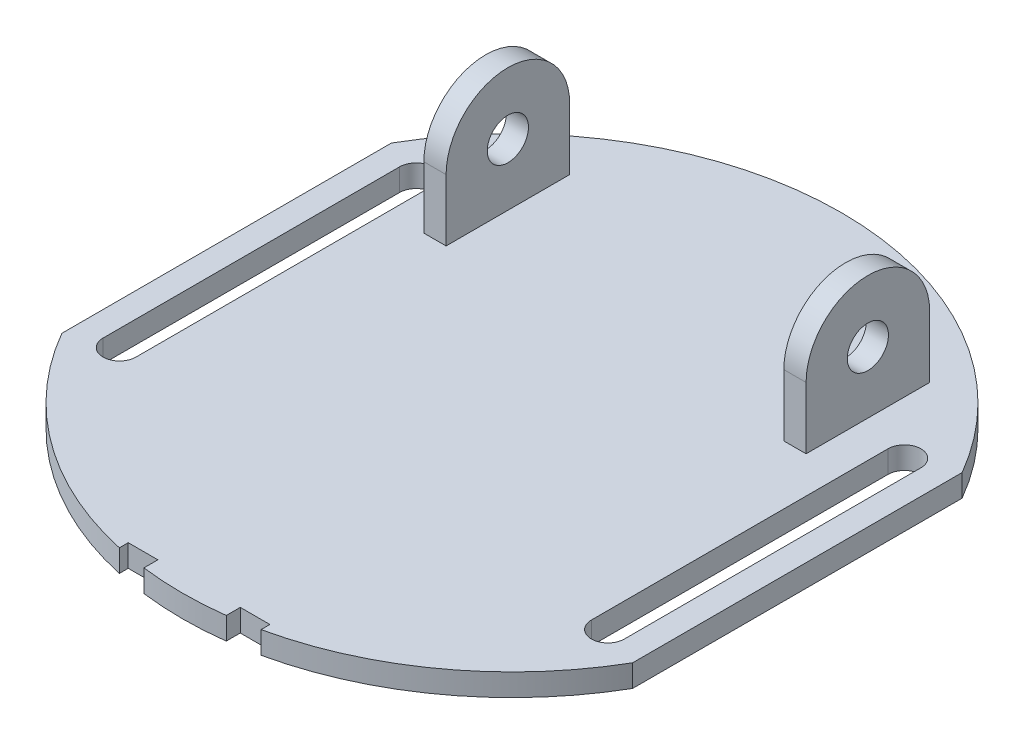
from build123d import *

# Parameters (mm, degrees)
BASE_DEPTH            = 2.7
WHEEL_HOLE_REACH      = 54.984
SKETCH3_R             = 2.5
BATTERY_HOLDER_DEPTH  = 2.7
IR_SENSOR_DIVOT_DEPTH = 56


with BuildPart() as part:
    # Sketch1 → Base (new body)
    with BuildSketch(Plane(origin=(0, 0, 0), x_dir=(1, 0, 0), z_dir=(0, 1, 0))):
        with BuildLine():
            Line((34.641016151, 20), (34.641016151, -20))
            ThreePointArc((34.641016151, -20), (0, -40), (-34.641016151, -20))
            Line((-34.641016151, -20), (-34.641016151, 20))
            ThreePointArc((-34.641016151, 20), (0, 40), (34.641016151, 20))
        make_face()
    extrude(amount=BASE_DEPTH)

    # Sketch2 → Wheel Hole (cut, up to next)
    with BuildSketch(Plane(origin=(0, 2.7, 0), x_dir=(-1, 0, 0), z_dir=(0, 1, 0)), mode=Mode.PRIVATE) as wheel_hole_sk1:
        with BuildLine():
            Line((27.641016151, -18), (27.641016151, 18))
            ThreePointArc((27.641016151, 18), (29.641016151, 20), (31.641016151, 18))
            Line((31.641016151, 18), (31.641016151, -18))
            ThreePointArc((31.641016151, -18), (29.641016151, -20), (27.641016151, -18))
        make_face()
    wheel_hole_tool1 = extrude(wheel_hole_sk1.sketch, amount=-WHEEL_HOLE_REACH, mode=Mode.PRIVATE) & part.part
    wheel_hole = wheel_hole_tool1.solids().sort_by_distance((-29.641016, 2.7, 0))[0]
    add(wheel_hole, mode=Mode.SUBTRACT)

    # Sketch3 → Battery Holder (add)
    with BuildSketch(Plane(origin=(-20.5, 0, 0), x_dir=(0, 0, -1), z_dir=(1, 0, 0))):
        with BuildLine():
            Line((27.5, 2.7), (27.5, 10.2))
            ThreePointArc((27.5, 10.2), (20, 17.7), (12.5, 10.2))
            Line((12.5, 10.2), (12.5, 2.7))
            Line((12.5, 2.7), (27.5, 2.7))
        make_face()
        with Locations((20, 10.2)):
            Circle(SKETCH3_R, mode=Mode.SUBTRACT)
    battery_holder = extrude(amount=-BATTERY_HOLDER_DEPTH)

    # Sketch5 → IR Sensor Divot (cut, symmetric)
    with BuildSketch(Plane(origin=(0, 2.7, 0), x_dir=(-1, 0, 0), z_dir=(0, 1, 0))):
        Polygon((5, 229.919345803), (5, 39.686269666), (5, 37.986269666), (8.6, 37.986269666), (8.6, 39.064561946), (8.6, 229.297638083), (73.346792401, 604.214089975), (69.746792401, 604.835797696), align=None)
    ir_sensor_divot = extrude(amount=IR_SENSOR_DIVOT_DEPTH, both=True, mode=Mode.SUBTRACT)

    # Mirror 2: Wheel Hole, Battery Holder, IR Sensor Divot across plane
    add(wheel_hole.mirror(Plane(origin=(0, 0, 0), x_dir=(0, 0, 1), z_dir=(1, 0, 0))), mode=Mode.SUBTRACT)
    add(battery_holder.mirror(Plane(origin=(0, 0, 0), x_dir=(0, 0, 1), z_dir=(1, 0, 0))))
    add(ir_sensor_divot.mirror(Plane(origin=(0, 0, 0), x_dir=(0, 0, 1), z_dir=(1, 0, 0))), mode=Mode.SUBTRACT)


solid = part.part
